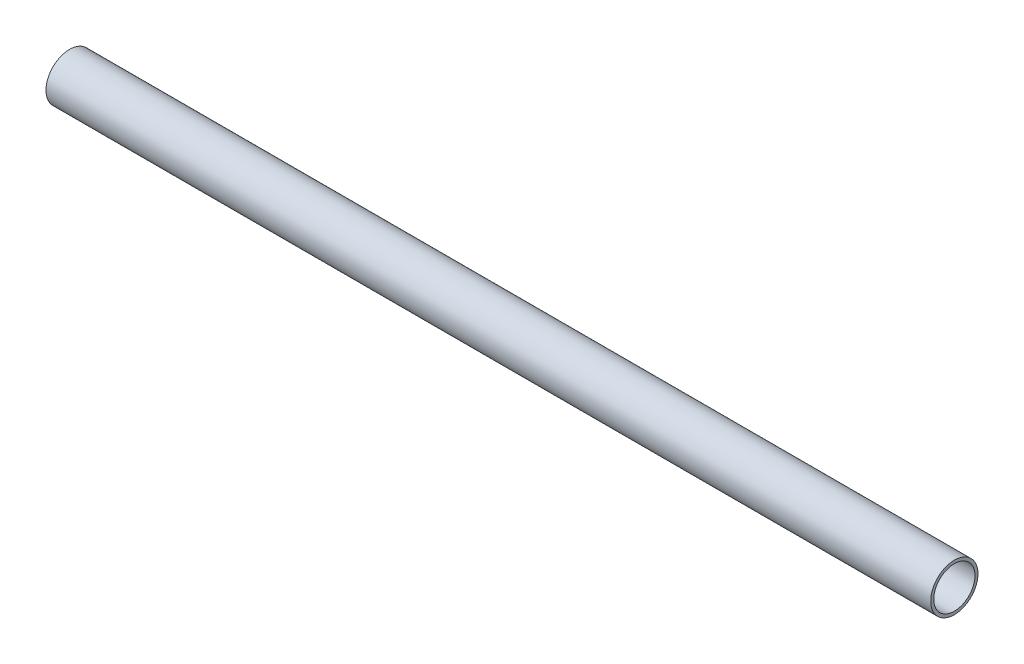
from build123d import *

# Parameters (mm, degrees)
SKIZZE1_R                       = 7.75
SKIZZE1_R_2                     = 6.75
AUFSATZ_LINEAR_AUSTRAGEN1_DEPTH = 290


with BuildPart() as part:
    # Skizze1 → Aufsatz-Linear austragen1 (new body)
    with BuildSketch(Plane(origin=(0, 0, 0), x_dir=(0, 0, -1), z_dir=(1, 0, 0))):
        Circle(SKIZZE1_R)
        Circle(SKIZZE1_R_2, mode=Mode.SUBTRACT)
    extrude(amount=AUFSATZ_LINEAR_AUSTRAGEN1_DEPTH)


solid = part.part
